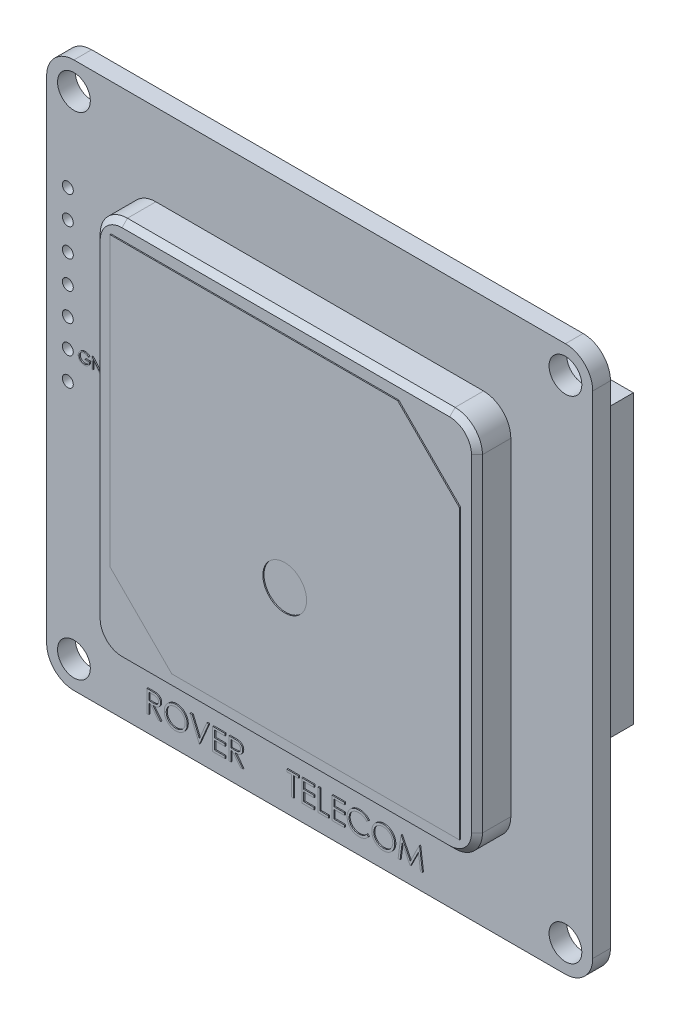
from build123d import *

# Parameters (mm, degrees)
SKETCH1_W                    = 50
SKETCH1_H                    = 50
BOSS_EXTRUDE1_DEPTH          = 1.62
SKETCH2_W                    = 35
SKETCH2_H                    = 35
BOSS_EXTRUDE2_DEPTH          = 3.1
SKETCH3_W                    = 32
SKETCH3_H                    = 32
BOSS_EXTRUDE3_DEPTH          = 0.1
F_3_0_3_DIAMETER_HOLE1_D     = 3
F_4_0_4_DIAMETER_HOLE1_D     = 4
F_4_0_4_DIAMETER_HOLE1_DEPTH = 0.1
FILLET1_R                    = 2.5
CHAMFER1_SIZE                = 5.656854249
CHAMFER2_SIZE                = 0.5
SKETCH8_W                    = 26.3
SKETCH8_H                    = 26.3
BOSS_EXTRUDE4_DEPTH          = 5.1
SKETCH9_W                    = 10.74
SKETCH9_H                    = 5.8
BOSS_EXTRUDE5_DEPTH          = 4.3
SKETCH9_3_W                  = 7.54
SKETCH9_3_H                  = 5.6
BOSS_EXTRUDE6_DEPTH          = 2.62
CUT_EXTRUDE1_DEPTH           = 37.83202954
CUT_EXTRUDE1_DEPTH_BACK      = 37.83202954
SKETCH10_R                   = 0.5
BOSS_EXTRUDE7_DEPTH          = 0.1
BOSS_EXTRUDE8_DEPTH          = 0.1


with BuildPart() as part:
    # Sketch1 → Boss-Extrude1 (new body)
    with BuildSketch(Plane.XY):
        Rectangle(SKETCH1_W, SKETCH1_H)
    extrude(amount=-BOSS_EXTRUDE1_DEPTH)

    # Sketch2 → Boss-Extrude2 (add)
    with BuildSketch(Plane.XY):
        Rectangle(SKETCH2_W, SKETCH2_H)
    extrude(amount=BOSS_EXTRUDE2_DEPTH)

    # Sketch3 → Boss-Extrude3 (add)
    with BuildSketch(Plane.XY.offset(3.1)):
        Rectangle(SKETCH3_W, SKETCH3_H)
    extrude(amount=BOSS_EXTRUDE3_DEPTH)

    # Ø3.0 (3) Diameter Hole1 (through all)
    with Locations(Plane.XY):
        with Locations((22.5, -22.5), (-22.5, 22.5), (22.5, 22.5), (-22.5, -22.5)):
            Hole(F_3_0_3_DIAMETER_HOLE1_D / 2)

    # Ø4.0 (4) Diameter Hole1
    with Locations(Plane.XY.offset(3.2)):
        with Locations((0, -4)):
            Hole(F_4_0_4_DIAMETER_HOLE1_D / 2, depth=F_4_0_4_DIAMETER_HOLE1_DEPTH)

    # Fillet1
    fillet1_edges = [part.edges().sort_by_distance(p)[0] for p in [
        (25, -25, -0.81),
        (25, 25, -0.81),
        (-25, -25, -0.81),
        (-25, 25, -0.81),
        (17.5, -17.5, 1.55),
        (17.5, 17.5, 1.55),
        (-17.5, -17.5, 1.55),
        (-17.5, 17.5, 1.55),
    ]]
    fillet(fillet1_edges, radius=FILLET1_R)

    # Chamfer1
    chamfer1_edges = [part.edges().sort_by_distance(p)[0] for p in [
        (-16, -16, 3.15),
        (16, 16, 3.15),
    ]]
    chamfer(chamfer1_edges, length=CHAMFER1_SIZE)

    # Chamfer2
    chamfer2_edges = [part.edges().sort_by_distance(p)[0] for p in [
        (17.5, 0, 3.1),
        (16.767766953, -16.767766953, 3.1),
        (16.767766953, 16.767766953, 3.1),
        (0, -17.5, 3.1),
        (0, 17.5, 3.1),
        (-16.767766953, -16.767766953, 3.1),
        (-16.767766953, 16.767766953, 3.1),
        (-17.5, 0, 3.1),
    ]]
    chamfer(chamfer2_edges, length=CHAMFER2_SIZE)

    # Sketch8 → Boss-Extrude4 (add)
    with BuildSketch(Plane(origin=(0, 0, -1.62), x_dir=(-1, 0, 0), z_dir=(0, 0, -1))):
        with Locations((-8.85, 4.35)):
            Rectangle(SKETCH8_W, SKETCH8_H)
    extrude(amount=BOSS_EXTRUDE4_DEPTH)

    # Sketch9 → Boss-Extrude5 (add)
    with BuildSketch(Plane(origin=(0, 0, -1.62), x_dir=(-1, 0, 0), z_dir=(0, 0, -1))):
        with Locations((-0.59, -22.1)):
            Rectangle(SKETCH9_W, SKETCH9_H)
        with Locations((11.35, -22.1)):
            Rectangle(SKETCH9_W, SKETCH9_H)
    extrude(amount=BOSS_EXTRUDE5_DEPTH)

    # Sketch9<3> → Boss-Extrude6 (add)
    with BuildSketch(Plane(origin=(0, 0, -1.62), x_dir=(-1, 0, 0), z_dir=(0, 0, -1))):
        with Locations((-13.23, -23.4)):
            Rectangle(SKETCH9_3_W, SKETCH9_3_H)
    extrude(amount=BOSS_EXTRUDE6_DEPTH)

    # Sketch10 → Cut-Extrude1 (cut, two sides: drawn at the far end of the back side and taken through both)
    with BuildSketch(Plane.XY.offset(-CUT_EXTRUDE1_DEPTH_BACK)):
        with Locations((-23.06, 14.6)):
            Circle(SKETCH10_R)
        with Locations((-23.06, 12.04)):
            Circle(SKETCH10_R)
        with Locations((-23.06, 9.48)):
            Circle(SKETCH10_R)
        with Locations((-23.06, 6.92)):
            Circle(SKETCH10_R)
        with Locations((-23.06, 4.36)):
            Circle(SKETCH10_R)
        with Locations((-23.06, 1.8)):
            Circle(SKETCH10_R)
        with Locations((-23.06, -0.76)):
            Circle(SKETCH10_R)
    extrude(amount=CUT_EXTRUDE1_DEPTH + CUT_EXTRUDE1_DEPTH_BACK, mode=Mode.SUBTRACT)

    # Sketch11 → Boss-Extrude7 (add)
    # profile 1 of 3: a face of its own
    with BuildSketch(Plane.XY):
        with BuildLine():
            Line((-21.023704934, 2.220769729), (-21.100628011, 2.147853062))
            add(Edge.make_bspline(
                [(-21.100628011, 2.147853062), (-21.114547693, 2.160947594), (-21.142055135, 2.186824412), (-21.186900919, 2.220398982), (-21.233690529, 2.249160725), (-21.282179813, 2.272562507), (-21.331167972, 2.291234724), (-21.380004765, 2.304528479), (-21.428189251, 2.313006347), (-21.460237028, 2.314020166), (-21.476028652, 2.314519729)],
                knots=[0, 0, 0, 0, 1.08915593, 2.152340314, 3.188132944, 4.216796309, 5.218260357, 6.173443236, 7.099959455, 8, 8, 8, 8], degree=3))
            add(Edge.make_bspline(
                [(-21.476028652, 2.314519729), (-21.485718566, 2.314401556), (-21.505073264, 2.314165516), (-21.53382239, 2.311152883), (-21.562270001, 2.306820065), (-21.590362394, 2.300550957), (-21.61815419, 2.292605511), (-21.645548731, 2.282666807), (-21.672597118, 2.271079595), (-21.699044569, 2.257690317), (-21.724684713, 2.242981789), (-21.748900952, 2.226682206), (-21.771847637, 2.20931398), (-21.793093473, 2.190442272), (-21.812760669, 2.170238025), (-21.831317347, 2.14907708), (-21.84811086, 2.126381303), (-21.863279764, 2.102568267), (-21.876811655, 2.078056213), (-21.888756985, 2.053081073), (-21.898784724, 2.027725686), (-21.906718855, 2.001958236), (-21.913264756, 1.975978067), (-21.917869786, 1.94960529), (-21.920465993, 1.922811665), (-21.920915073, 1.904869592), (-21.921140832, 1.895849857)],
                knots=[0, 0, 0, 0, 1.02818874, 2.053710826, 3.065248034, 4.081641283, 5.106893873, 6.131558223, 7.173050175, 8.228653731, 9.27666206, 10.308777013, 11.325269123, 12.329503258, 13.32196095, 14.316845687, 15.314881793, 16.315733098, 17.311955233, 18.285320748, 19.252783886, 20.203351036, 21.145449891, 22.095197417, 23.042428769, 24, 24, 24, 24], degree=3))
            add(Edge.make_bspline(
                [(-21.921140832, 1.895849857), (-21.920924912, 1.886629623), (-21.920493663, 1.868214334), (-21.917733571, 1.840730313), (-21.912611217, 1.813654484), (-21.9057633, 1.786897874), (-21.897197353, 1.760414661), (-21.886519448, 1.734319658), (-21.873872134, 1.708613832), (-21.859233119, 1.683528798), (-21.843179918, 1.659093649), (-21.82519618, 1.636076643), (-21.806093157, 1.614171278), (-21.785174899, 1.593863917), (-21.763112173, 1.574611375), (-21.739245809, 1.556944083), (-21.714045106, 1.540521733), (-21.687471616, 1.525551299), (-21.659813679, 1.512177432), (-21.631454606, 1.50028489), (-21.602303802, 1.490490794), (-21.572514462, 1.482508478), (-21.542122099, 1.475965536), (-21.510972441, 1.471756256), (-21.479294524, 1.468701733), (-21.457940629, 1.468478399), (-21.447182498, 1.468365883)],
                knots=[0, 0, 0, 0, 0.93586088, 1.869166235, 2.799637598, 3.729985548, 4.670839027, 5.622275134, 6.589130586, 7.576015415, 8.568469353, 9.55398029, 10.53834874, 11.515998671, 12.510579167, 13.508179873, 14.527009472, 15.561807829, 16.601455013, 17.643573243, 18.680854198, 19.719860599, 20.772568776, 21.833555941, 22.908541556, 24, 24, 24, 24], degree=3))
            add(Edge.make_bspline(
                [(-21.447182498, 1.468365883), (-21.434217256, 1.468636904), (-21.408757897, 1.4691691), (-21.371333199, 1.47331204), (-21.335389464, 1.479782552), (-21.301027692, 1.489258523), (-21.268207972, 1.501345287), (-21.236809989, 1.515915397), (-21.207080943, 1.5335277), (-21.178931465, 1.553405948), (-21.153000841, 1.575553043), (-21.129613948, 1.599451458), (-21.109143808, 1.624985192), (-21.091285323, 1.652003853), (-21.076511422, 1.680731083), (-21.064384909, 1.711026101), (-21.055089683, 1.742902533), (-21.051273975, 1.764928713), (-21.04934596, 1.77605819)],
                knots=[0, 0, 0, 0, 1.13008108, 2.219097802, 3.278683437, 4.311054135, 5.322181354, 6.324827112, 7.324222904, 8.330512327, 9.32562643, 10.293043162, 11.24128371, 12.174520618, 13.111833804, 14.052305215, 15.015860969, 16, 16, 16, 16], degree=3))
            Line((-21.04934596, 1.77605819), (-21.382679293, 1.77605819))
            Line((-21.382679293, 1.77605819), (-21.382679293, 1.878622293))
            Line((-21.382679293, 1.878622293), (-20.95960237, 1.878622293))
            add(Edge.make_bspline(
                [(-20.95960237, 1.878622293), (-20.960089755, 1.859505867), (-20.961043656, 1.82209157), (-20.967734775, 1.767528635), (-20.978539493, 1.715993866), (-20.993299582, 1.667432988), (-21.012406805, 1.621914819), (-21.035656099, 1.579393143), (-21.063419562, 1.540142663), (-21.094708259, 1.503842947), (-21.129822533, 1.471463172), (-21.167813567, 1.443004333), (-21.20874413, 1.419032157), (-21.252575503, 1.399529111), (-21.299164199, 1.384307969), (-21.348618021, 1.37351609), (-21.400869907, 1.367050386), (-21.436680386, 1.366224278), (-21.454994998, 1.36580178)],
                knots=[0, 0, 0, 0, 1.140356446, 2.231883559, 3.274166699, 4.278491846, 5.25512956, 6.21435461, 7.1637429, 8.11826594, 9.068280886, 10.0076534, 10.945064095, 11.891975133, 12.864533718, 13.863980011, 14.907571808, 16, 16, 16, 16], degree=3))
            add(Edge.make_bspline(
                [(-21.454994998, 1.36580178), (-21.466283608, 1.365964386), (-21.488548386, 1.366285098), (-21.521431508, 1.36856434), (-21.553407971, 1.372073076), (-21.584473116, 1.377371683), (-21.614741214, 1.383861584), (-21.644061096, 1.392172075), (-21.67254445, 1.401791703), (-21.700235303, 1.412733324), (-21.726882317, 1.42541094), (-21.752604179, 1.439499409), (-21.777543072, 1.454926083), (-21.801529119, 1.471957754), (-21.824687297, 1.490467028), (-21.84686828, 1.510491005), (-21.868196246, 1.531968468), (-21.881556378, 1.547219613), (-21.888288267, 1.554904344)],
                knots=[0, 0, 0, 0, 1.107784379, 2.184907829, 3.233506516, 4.263428166, 5.276301166, 6.270063455, 7.25232949, 8.225834625, 9.190232166, 10.146266622, 11.1027726, 12.066435141, 13.031522626, 14.010570082, 14.99756817, 16, 16, 16, 16], degree=3))
            add(Edge.make_bspline(
                [(-21.888288267, 1.554904344), (-21.898055677, 1.567095959), (-21.917428366, 1.591276821), (-21.942364982, 1.630019663), (-21.963622526, 1.67013448), (-21.980870475, 1.711732945), (-21.9943385, 1.754776149), (-22.003997429, 1.799209089), (-22.009656654, 1.845088983), (-22.010471951, 1.876136202), (-22.010884421, 1.891843447)],
                knots=[0, 0, 0, 0, 1.023165419, 2.029347347, 3.013907458, 3.994755782, 4.975994455, 5.96558838, 6.970761222, 8, 8, 8, 8], degree=3))
            add(Edge.make_bspline(
                [(-22.010884421, 1.891843447), (-22.010732353, 1.903605233), (-22.01043015, 1.926979321), (-22.006765717, 1.961681409), (-22.001508169, 1.995767321), (-21.993780439, 2.029209194), (-21.984038649, 2.062029363), (-21.97188051, 2.094243067), (-21.957724825, 2.125869316), (-21.941271827, 2.156690421), (-21.922961981, 2.186297396), (-21.903090489, 2.214571055), (-21.881375175, 2.240996502), (-21.858170661, 2.265908401), (-21.833200092, 2.288993786), (-21.8066974, 2.310466389), (-21.778642159, 2.330355014), (-21.748946108, 2.348346395), (-21.718052483, 2.364507429), (-21.68603534, 2.378675776), (-21.652904451, 2.390385294), (-21.618908029, 2.40032066), (-21.583788743, 2.407667843), (-21.547801447, 2.412996056), (-21.510758558, 2.416641942), (-21.485719692, 2.416935157), (-21.473023844, 2.417083831)],
                knots=[0, 0, 0, 0, 1.008945113, 2.00506715, 2.99143336, 3.967273523, 4.948097931, 5.927297278, 6.919902385, 7.919676788, 8.923139349, 9.905703106, 10.883022732, 11.856032218, 12.825136022, 13.798837087, 14.781400844, 15.773989409, 16.776158564, 17.77167057, 18.775803737, 19.789618931, 20.80898985, 21.851988756, 22.910860228, 24, 24, 24, 24], degree=3))
            add(Edge.make_bspline(
                [(-21.473023844, 2.417083831), (-21.46267006, 2.416918262), (-21.442139724, 2.416589958), (-21.411589514, 2.414314345), (-21.38151151, 2.410707521), (-21.351861113, 2.405785582), (-21.322739294, 2.399081671), (-21.294063093, 2.391059304), (-21.265790939, 2.381718783), (-21.23801144, 2.370579113), (-21.210537807, 2.35793522), (-21.183217281, 2.343702813), (-21.15614321, 2.327638526), (-21.129268644, 2.309694659), (-21.102424113, 2.290179397), (-21.076034216, 2.26853459), (-21.049461946, 2.245613803), (-21.032375713, 2.229133179), (-21.023704934, 2.220769729)],
                knots=[0, 0, 0, 0, 0.985871117, 1.954866573, 2.915460327, 3.869826059, 4.81536089, 5.759505086, 6.70452669, 7.649098992, 8.607881297, 9.583363685, 10.581137262, 11.603961102, 12.659522466, 13.73993555, 14.853081303, 16, 16, 16, 16], degree=3))
        make_face()
    # profile 2 of 3: a face of its own
    with BuildSketch(Plane.XY):
        Polygon((-20.754474165, 1.391442806), (-20.754474165, 2.391442806), (-20.735644037, 2.391442806), (-20.074986985, 1.604383511), (-20.074986985, 2.391442806), (-19.985243396, 2.391442806), (-19.985243396, 1.391442806), (-20.005676088, 1.391442806), (-20.664730575, 2.176699216), (-20.664730575, 1.391442806), align=None)
    # profile 3 of 3: a face of its own
    with BuildSketch(Plane.XY):
        with BuildLine():
            Line((-19.728833139, 1.391442806), (-19.728833139, 2.391442806))
            Line((-19.728833139, 2.391442806), (-19.526910062, 2.391442806))
            add(Edge.make_bspline(
                [(-19.526910062, 2.391442806), (-19.509347494, 2.391316357), (-19.475416704, 2.391072059), (-19.426384576, 2.38952309), (-19.381017787, 2.386782957), (-19.339465542, 2.382791664), (-19.301613767, 2.377890797), (-19.26756845, 2.371747825), (-19.237153552, 2.364494062), (-19.218447998, 2.358309647), (-19.20960237, 2.355385113)],
                knots=[0, 0, 0, 0, 1.314313732, 2.53924729, 3.670748893, 4.714932338, 5.66265055, 6.526160246, 7.303039223, 8, 8, 8, 8], degree=3))
            add(Edge.make_bspline(
                [(-19.20960237, 2.355385113), (-19.198032444, 2.35097634), (-19.175154961, 2.342258771), (-19.142581497, 2.325814113), (-19.111917108, 2.307181798), (-19.082997352, 2.286337266), (-19.05648283, 2.262690309), (-19.031337717, 2.237245428), (-19.008590653, 2.209077331), (-18.987759711, 2.178770191), (-18.968978094, 2.146681033), (-18.952652621, 2.112871002), (-18.939094337, 2.0775118), (-18.927839129, 2.040701758), (-18.918968713, 2.002359935), (-18.912916732, 1.962441688), (-18.908925021, 1.921104777), (-18.908523863, 1.89305493), (-18.908320319, 1.878822613)],
                knots=[0, 0, 0, 0, 0.984719456, 1.947108742, 2.898477687, 3.838006223, 4.779231079, 5.722358779, 6.681677486, 7.655904652, 8.64651281, 9.637519902, 10.640069247, 11.656948941, 12.698408672, 13.768548281, 14.867775369, 16, 16, 16, 16], degree=3))
            add(Edge.make_bspline(
                [(-18.908320319, 1.878822613), (-18.908500024, 1.86646226), (-18.908854151, 1.842104891), (-18.912033956, 1.806207493), (-18.916655761, 1.771375044), (-18.923811246, 1.737773415), (-18.932497679, 1.70510821), (-18.943630294, 1.673727569), (-18.956383292, 1.643343623), (-18.971254686, 1.614367201), (-18.987580796, 1.586914809), (-19.005101294, 1.561036087), (-19.023797493, 1.537100309), (-19.043847674, 1.515034992), (-19.064992736, 1.494873398), (-19.087371116, 1.476447108), (-19.111040559, 1.460116663), (-19.135895051, 1.445240347), (-19.16265966, 1.432263102), (-19.191841336, 1.4212831), (-19.223564529, 1.412184067), (-19.257751374, 1.404592382), (-19.294460939, 1.398570296), (-19.333729215, 1.394534183), (-19.375495869, 1.391804774), (-19.404175659, 1.391565805), (-19.418937306, 1.391442806)],
                knots=[0, 0, 0, 0, 1.105936401, 2.179363191, 3.223086493, 4.248585256, 5.251745608, 6.245858792, 7.225916811, 8.198733463, 9.158002045, 10.082870192, 10.993790845, 11.873723703, 12.748670949, 13.606408763, 14.465103618, 15.319838547, 16.196477973, 17.123216899, 18.106603292, 19.147568657, 20.255746949, 21.433717677, 22.679120308, 24, 24, 24, 24], degree=3))
            Line((-19.418937306, 1.391442806), (-19.728833139, 1.391442806))
        make_face()
        with BuildLine():
            Line((-19.639089549, 1.494006908), (-19.524305896, 1.494006908))
            add(Edge.make_bspline(
                [(-19.524305896, 1.494006908), (-19.507812075, 1.494077793), (-19.476088419, 1.49421413), (-19.430471848, 1.495410474), (-19.38879202, 1.497365313), (-19.351043018, 1.50010105), (-19.317246154, 1.503720654), (-19.287330797, 1.507756341), (-19.261395009, 1.512784184), (-19.245700884, 1.517341601), (-19.238448524, 1.519447613)],
                knots=[0, 0, 0, 0, 1.375205317, 2.645023457, 3.804390687, 4.853969522, 5.800190428, 6.637939096, 7.370582563, 8, 8, 8, 8], degree=3))
            add(Edge.make_bspline(
                [(-19.238448524, 1.519447613), (-19.22932042, 1.522662344), (-19.211282238, 1.529015022), (-19.185316214, 1.540602926), (-19.161099927, 1.554329231), (-19.138211348, 1.569587024), (-19.116975161, 1.586914453), (-19.097139699, 1.605934735), (-19.078744899, 1.626744671), (-19.061980811, 1.649318432), (-19.046978438, 1.673515516), (-19.033986658, 1.69909804), (-19.022600506, 1.7257857), (-19.013663765, 1.753988317), (-19.006659313, 1.783453762), (-19.001697973, 1.814184109), (-18.998608052, 1.846173618), (-18.998247638, 1.867931368), (-18.998063908, 1.879022934)],
                knots=[0, 0, 0, 0, 0.998632004, 1.973411704, 2.929992603, 3.868527914, 4.809262121, 5.754881198, 6.702106254, 7.672490631, 8.653608572, 9.636854334, 10.631411391, 11.644891563, 12.686317036, 13.754757253, 14.855430412, 16, 16, 16, 16], degree=3))
            add(Edge.make_bspline(
                [(-18.998063908, 1.879022934), (-18.998210562, 1.890718214), (-18.998498664, 1.913693695), (-19.002119896, 1.947405322), (-19.007411769, 1.979828365), (-19.01506425, 2.010964993), (-19.02481593, 2.04087595), (-19.036985828, 2.069395811), (-19.050890576, 2.096825773), (-19.067434387, 2.122532735), (-19.085553128, 2.146845052), (-19.105661093, 2.169117885), (-19.127438818, 2.18940197), (-19.150648775, 2.208013203), (-19.175945089, 2.224202824), (-19.202731858, 2.238684733), (-19.23140205, 2.250974988), (-19.251348535, 2.257511806), (-19.261485383, 2.260833831)],
                knots=[0, 0, 0, 0, 1.122418816, 2.205001699, 3.251619955, 4.274784885, 5.280384055, 6.268708349, 7.249350384, 8.229342522, 9.199999885, 10.157847722, 11.105861043, 12.055065948, 13.010012805, 13.98527497, 14.976112212, 16, 16, 16, 16], degree=3))
            add(Edge.make_bspline(
                [(-19.261485383, 2.260833831), (-19.269871425, 2.263152811), (-19.28770245, 2.268083597), (-19.31679944, 2.273462275), (-19.349546626, 2.278206418), (-19.386089397, 2.282223), (-19.4263861, 2.285105092), (-19.470467725, 2.287268325), (-19.518353326, 2.288727363), (-19.551548336, 2.288826993), (-19.568777049, 2.288878703)],
                knots=[0, 0, 0, 0, 0.674548936, 1.434276114, 2.292660221, 3.240891867, 4.284742987, 5.42552168, 6.663806718, 8, 8, 8, 8], degree=3))
            Line((-19.568777049, 2.288878703), (-19.639089549, 2.288878703))
            Line((-19.639089549, 2.288878703), (-19.639089549, 1.494006908))
        make_face(mode=Mode.SUBTRACT)
    extrude(amount=BOSS_EXTRUDE7_DEPTH)

    # Sketch12 → Boss-Extrude8 (add)
    # profile 1 of 12: a face of its own
    with BuildSketch(Plane.XY):
        with BuildLine():
            Line((-15.72093604, -21.389453916), (-15.320695656, -21.389453916))
            add(Edge.make_bspline(
                [(-15.320695656, -21.389453916), (-15.29398644, -21.389542822), (-15.242701786, -21.389713532), (-15.169231345, -21.390665396), (-15.102473004, -21.3933936), (-15.042461667, -21.395741362), (-14.989198436, -21.400022471), (-14.942519984, -21.404114269), (-14.9026413, -21.409470647), (-14.878500813, -21.414445174), (-14.867570656, -21.416697506)],
                knots=[0, 0, 0, 0, 1.410062039, 2.707475311, 3.878576406, 4.937260626, 5.877586885, 6.699081471, 7.410979367, 8, 8, 8, 8], degree=3))
            add(Edge.make_bspline(
                [(-14.867570656, -21.416697506), (-14.852938299, -21.4203128), (-14.823985734, -21.427466265), (-14.782299982, -21.442586037), (-14.742577511, -21.460082965), (-14.704983326, -21.480633663), (-14.669705731, -21.50439068), (-14.636380982, -21.530943892), (-14.60485786, -21.56014801), (-14.576411214, -21.592739348), (-14.549588899, -21.626931639), (-14.526966826, -21.663905214), (-14.507465981, -21.702568945), (-14.491939971, -21.74331604), (-14.479438272, -21.785751339), (-14.470623278, -21.830259222), (-14.465336885, -21.876636922), (-14.464798682, -21.908270013), (-14.464525784, -21.924309685)],
                knots=[0, 0, 0, 0, 1.027469482, 2.033020251, 3.019912614, 3.986113645, 4.951240523, 5.91722682, 6.890402269, 7.87763091, 8.8651537, 9.85103654, 10.82876324, 11.815024772, 12.821070561, 13.842952187, 14.906261191, 16, 16, 16, 16], degree=3))
            add(Edge.make_bspline(
                [(-14.464525784, -21.924309685), (-14.465365212, -21.950958316), (-14.467003152, -22.002956698), (-14.48227464, -22.078420059), (-14.507289794, -22.148813953), (-14.541760245, -22.214049746), (-14.585657088, -22.272855829), (-14.638414112, -22.324507518), (-14.700060747, -22.367730325), (-14.757448927, -22.397703356), (-14.808142756, -22.416899304), (-14.849876077, -22.430405795), (-14.895400064, -22.440841203), (-14.944278541, -22.45018985), (-14.996714916, -22.457247961), (-15.05258351, -22.462417444), (-15.111924168, -22.465648329), (-15.15268935, -22.466129474), (-15.173660399, -22.466376993)],
                knots=[0, 0, 0, 0, 1.260483769, 2.459530307, 3.627416485, 4.787058657, 5.939039949, 7.08810263, 8.267026773, 9.491475466, 10.141966685, 10.831826277, 11.566392101, 12.351337768, 13.187381173, 14.07005841, 15.007169909, 16, 16, 16, 16], degree=3))
            Line((-15.173660399, -22.466376993), (-14.438884758, -23.389453916))
            Line((-14.438884758, -23.389453916), (-14.660839887, -23.389453916))
            Line((-14.660839887, -23.389453916), (-15.395615528, -22.466376993))
            Line((-15.395615528, -22.466376993), (-15.541448861, -22.466376993))
            Line((-15.541448861, -22.466376993), (-15.541448861, -23.389453916))
            Line((-15.541448861, -23.389453916), (-15.72093604, -23.389453916))
            Line((-15.72093604, -23.389453916), (-15.72093604, -21.389453916))
        make_face()
        with BuildLine():
            Line((-15.541448861, -21.594582121), (-15.541448861, -22.261248788))
            Line((-15.541448861, -22.261248788), (-15.175262964, -22.264053275))
            add(Edge.make_bspline(
                [(-15.175262964, -22.264053275), (-15.158165798, -22.264060839), (-15.125026623, -22.264075499), (-15.077083386, -22.261793342), (-15.032443322, -22.25919716), (-14.991277178, -22.255226105), (-14.953566563, -22.25010835), (-14.919330327, -22.243706645), (-14.888512583, -22.236248323), (-14.852570561, -22.224704537), (-14.812435401, -22.206415384), (-14.768817424, -22.179806527), (-14.731673231, -22.146338459), (-14.700291595, -22.108067913), (-14.675074777, -22.065990056), (-14.65729646, -22.020609274), (-14.646015065, -21.973071218), (-14.644684467, -21.940398013), (-14.644012964, -21.923909044)],
                knots=[0, 0, 0, 0, 1.146690395, 2.22261258, 3.21895312, 4.145990853, 4.996080663, 5.770904154, 6.481378293, 7.121626537, 8.300444488, 9.431385265, 10.535395872, 11.636531494, 12.74115979, 13.810798291, 14.895190096, 16, 16, 16, 16], degree=3))
            add(Edge.make_bspline(
                [(-14.644012964, -21.923909044), (-14.64469989, -21.907825288), (-14.646061127, -21.875953151), (-14.657174709, -21.829292631), (-14.675968641, -21.785254374), (-14.701295635, -21.744017525), (-14.732152294, -21.706585676), (-14.768333902, -21.674558732), (-14.808851156, -21.648130466), (-14.846720412, -21.631242249), (-14.880568534, -21.620888047), (-14.909956911, -21.613601667), (-14.94316347, -21.607747685), (-14.980349446, -21.603057365), (-15.021356092, -21.599025968), (-15.06639075, -21.596310666), (-15.115154624, -21.594702744), (-15.148952871, -21.594623264), (-15.166448861, -21.594582121)],
                knots=[0, 0, 0, 0, 1.101028733, 2.181837193, 3.264309656, 4.369019818, 5.486613113, 6.575447106, 7.666700264, 8.788928104, 9.402425223, 10.0903467, 10.862060571, 11.710948788, 12.657782767, 13.684531032, 14.801375019, 16, 16, 16, 16], degree=3))
            Line((-15.166448861, -21.594582121), (-15.541448861, -21.594582121))
        make_face(mode=Mode.SUBTRACT)
    # profile 2 of 12: a face of its own
    with BuildSketch(Plane.XY):
        with BuildLine():
            add(Edge.make_bspline(
                [(-13.092730912, -21.338171865), (-13.055697709, -21.339109853), (-12.982961442, -21.340952139), (-12.8760615, -21.355054484), (-12.77400716, -21.37945185), (-12.675967081, -21.411944982), (-12.583113952, -21.455290345), (-12.49474887, -21.507681859), (-12.411082085, -21.569668407), (-12.333241296, -21.640770822), (-12.262008753, -21.718132796), (-12.199251103, -21.800691601), (-12.146655507, -21.88794806), (-12.103463628, -21.979639963), (-12.069578709, -22.075559945), (-12.046196398, -22.176219375), (-12.031260312, -22.280966055), (-12.029514154, -22.352409978), (-12.028628348, -22.388652634)],
                knots=[0, 0, 0, 0, 1.065120563, 2.091984664, 3.0946048, 4.079830382, 5.057816894, 6.036188127, 7.030412546, 8.04752943, 9.064399622, 10.05169764, 11.02544977, 11.989514704, 12.962713494, 13.945757189, 14.957906945, 16, 16, 16, 16], degree=3))
            add(Edge.make_bspline(
                [(-12.028628348, -22.388652634), (-12.029514024, -22.424628317), (-12.031259793, -22.495540558), (-12.04621338, -22.599622526), (-12.06966538, -22.699674352), (-12.103148961, -22.795529011), (-12.146134949, -22.887287619), (-12.199080761, -22.974708735), (-12.261447167, -23.05782102), (-12.332422511, -23.135713972), (-12.409794535, -23.207141098), (-12.492783258, -23.269380455), (-12.579522298, -23.322937098), (-12.671127846, -23.365670626), (-12.76638501, -23.399826009), (-12.866146337, -23.423113226), (-12.969944368, -23.438134394), (-13.040727799, -23.43985926), (-13.076705271, -23.440735967)],
                knots=[0, 0, 0, 0, 1.043624062, 2.057103931, 3.04512605, 4.022047818, 4.998200453, 5.980619268, 6.982898556, 8.009068085, 9.034988726, 10.034168286, 11.015286542, 11.987931943, 12.962482838, 13.94673481, 14.956375938, 16, 16, 16, 16], degree=3))
            add(Edge.make_bspline(
                [(-13.076705271, -23.440735967), (-13.112947739, -23.439850603), (-13.184391291, -23.438105315), (-13.289269597, -23.423144512), (-13.389999736, -23.399749482), (-13.486293651, -23.366315518), (-13.57820504, -23.323105672), (-13.665913658, -23.270417455), (-13.749067457, -23.207899089), (-13.826977026, -23.136946761), (-13.898262282, -23.059705874), (-13.960410497, -22.976943442), (-14.013110562, -22.890283181), (-14.056175323, -22.799484596), (-14.0902693, -22.704986629), (-14.113529196, -22.606158928), (-14.128578312, -22.503564924), (-14.13031251, -22.433711839), (-14.131192451, -22.398268018)],
                knots=[0, 0, 0, 0, 1.053102029, 2.075944431, 3.073151272, 4.055350789, 5.033113405, 6.020478099, 7.024410459, 8.052272461, 9.079885166, 10.07527673, 11.055994387, 12.023226415, 12.992069828, 13.970394897, 14.97016774, 16, 16, 16, 16], degree=3))
            add(Edge.make_bspline(
                [(-14.131192451, -22.398268018), (-14.130886945, -22.374477922), (-14.130279787, -22.327197851), (-14.122970248, -22.256988365), (-14.112363562, -22.187907989), (-14.097162469, -22.120153162), (-14.077281516, -22.053889742), (-14.053823215, -21.988660735), (-14.025171875, -21.925127178), (-13.992782933, -21.862988097), (-13.956633328, -21.803212151), (-13.916704329, -21.746709532), (-13.874398404, -21.693006106), (-13.828019322, -21.643493532), (-13.779095639, -21.596731443), (-13.726833709, -21.553438461), (-13.671552426, -21.513224204), (-13.613013923, -21.476984009), (-13.552660623, -21.444207361), (-13.490445322, -21.416080589), (-13.427212995, -21.391939982), (-13.362667482, -21.372373796), (-13.296980184, -21.356926918), (-13.230007735, -21.346408431), (-13.161803492, -21.339080249), (-13.115854167, -21.338475962), (-13.092730912, -21.338171865)],
                knots=[0, 0, 0, 0, 1.037015668, 2.060948919, 3.074880161, 4.083647147, 5.086022904, 6.090072063, 7.104153813, 8.122640571, 9.144368836, 10.147691507, 11.138137339, 12.123020368, 13.103399296, 14.087645067, 15.080126199, 16.082011238, 17.087798457, 18.072939717, 19.057185487, 20.037253025, 21.01195951, 21.997135196, 22.992090687, 24, 24, 24, 24], degree=3))
        make_face()
        with BuildLine():
            add(Edge.make_bspline(
                [(-13.08391681, -21.54330007), (-13.1028966, -21.543531435), (-13.140674733, -21.543991955), (-13.196837326, -21.550058079), (-13.252261288, -21.558703729), (-13.306958066, -21.571036027), (-13.360698803, -21.587838343), (-13.413984426, -21.607176005), (-13.466329029, -21.630730914), (-13.517559805, -21.657343887), (-13.567225562, -21.686800414), (-13.614089963, -21.719355709), (-13.658274331, -21.754246312), (-13.699670483, -21.791553647), (-13.738156867, -21.831467705), (-13.774490982, -21.873383383), (-13.807216457, -21.918498749), (-13.837208216, -21.96559041), (-13.864046981, -22.014597028), (-13.887912898, -22.065002664), (-13.907435189, -22.117218485), (-13.923356547, -22.170678004), (-13.936556439, -22.225296552), (-13.944918681, -22.281488466), (-13.951051458, -22.338971387), (-13.951485656, -22.37781816), (-13.951705271, -22.397466736)],
                knots=[0, 0, 0, 0, 1.008559885, 2.007477868, 2.99961109, 3.989939068, 4.984837346, 5.991145699, 7.001802488, 8.033829008, 9.059044045, 10.069351652, 11.065060232, 12.050310815, 13.029377138, 14.011219647, 14.996725999, 15.989392538, 16.977580475, 17.965360261, 18.951710183, 19.937753436, 20.929683414, 21.935841486, 22.955955122, 24, 24, 24, 24], degree=3))
            add(Edge.make_bspline(
                [(-13.951705271, -22.397466736), (-13.950976779, -22.426359434), (-13.949543608, -22.483200308), (-13.936996426, -22.566496391), (-13.917669583, -22.64654684), (-13.889179659, -22.722913645), (-13.853550737, -22.796253235), (-13.809535371, -22.865915009), (-13.757387322, -22.931917795), (-13.698151021, -22.993800806), (-13.633395189, -23.050284122), (-13.564633629, -23.099863213), (-13.492602996, -23.141811927), (-13.417115451, -23.175986254), (-13.338574001, -23.203066104), (-13.256472543, -23.221625322), (-13.171357994, -23.233839868), (-13.113340477, -23.235012872), (-13.08391681, -23.235607762)],
                knots=[0, 0, 0, 0, 1.032063989, 2.030389145, 3.003944642, 3.970395727, 4.937377036, 5.913328081, 6.909231446, 7.93887556, 8.970685674, 9.976071282, 10.964166581, 11.944589148, 12.933237628, 13.927779006, 14.949070134, 16, 16, 16, 16], degree=3))
            add(Edge.make_bspline(
                [(-13.08391681, -23.235607762), (-13.064139952, -23.235336045), (-13.024916502, -23.234797149), (-12.966576204, -23.229369334), (-12.90928694, -23.220665408), (-12.853129066, -23.208133605), (-12.798166316, -23.192449487), (-12.744169286, -23.1738165), (-12.69171312, -23.150570098), (-12.64013607, -23.124885554), (-12.590766789, -23.095605464), (-12.543637913, -23.064155093), (-12.499937353, -23.029315881), (-12.45857217, -22.992562845), (-12.419927776, -22.953154932), (-12.384265499, -22.911143377), (-12.351705424, -22.866263001), (-12.321725054, -22.819242769), (-12.294980333, -22.770102054), (-12.27167799, -22.719513666), (-12.251908781, -22.667602175), (-12.235949636, -22.614292706), (-12.223443658, -22.559686506), (-12.214826561, -22.503710462), (-12.208798881, -22.446476552), (-12.208344552, -22.407765777), (-12.208115528, -22.388251993)],
                knots=[0, 0, 0, 0, 1.047197238, 2.076906641, 3.100256066, 4.114471768, 5.12198147, 6.126382909, 7.136867548, 8.15857795, 9.17633901, 10.174870724, 11.156907918, 12.133735059, 13.104061851, 14.077631395, 15.04955518, 16.038496417, 17.029181396, 18.010275684, 18.986308667, 19.968651475, 20.955262928, 21.950658345, 22.966943676, 24, 24, 24, 24], degree=3))
            add(Edge.make_bspline(
                [(-12.208115528, -22.388251993), (-12.208344735, -22.368871705), (-12.20879941, -22.330427333), (-12.214823681, -22.27359258), (-12.223452762, -22.218019316), (-12.235888595, -22.163925714), (-12.251917254, -22.111297986), (-12.271681443, -22.060185558), (-12.294987328, -22.010398018), (-12.321734885, -21.96205842), (-12.35180107, -21.915672855), (-12.384654923, -21.87132862), (-12.420863694, -21.829858482), (-12.459392851, -21.790238657), (-12.501204785, -21.753314148), (-12.546110096, -21.719072708), (-12.593563626, -21.68668798), (-12.643807761, -21.657473373), (-12.695661449, -21.630493812), (-12.748869425, -21.607378953), (-12.80282891, -21.587737741), (-12.857402688, -21.57098519), (-12.913050105, -21.55875203), (-12.96939515, -21.550050287), (-13.026359869, -21.543994067), (-13.06467028, -21.543532136), (-13.08391681, -21.54330007)],
                knots=[0, 0, 0, 0, 1.02996197, 2.043119294, 3.035359645, 4.018872909, 4.991431989, 5.957985074, 6.929999688, 7.912076566, 8.892894881, 9.867085534, 10.843653904, 11.817741046, 12.803660682, 13.806313499, 14.818574707, 15.856120519, 16.894564902, 17.924820532, 18.937903209, 19.946497019, 20.957711757, 21.963978472, 22.977135795, 24, 24, 24, 24], degree=3))
        make_face(mode=Mode.SUBTRACT)
    # profile 3 of 12: a face of its own
    with BuildSketch(Plane.XY):
        Polygon((-11.772218092, -21.389453916), (-11.579910399, -21.389453916), (-10.913243733, -22.965575711), (-10.246577066, -21.389453916), (-10.054269374, -21.389453916), (-10.90042322, -23.389453916), (-10.926064246, -23.389453916), align=None)
    # profile 4 of 12: a face of its own
    with BuildSketch(Plane.XY):
        Polygon((-9.695295015, -21.389453916), (-8.567089887, -21.389453916), (-8.567089887, -21.594582121), (-9.515807835, -21.594582121), (-9.515807835, -22.209966736), (-8.567089887, -22.209966736), (-8.567089887, -22.415094941), (-9.515807835, -22.415094941), (-9.515807835, -23.184325711), (-8.567089887, -23.184325711), (-8.567089887, -23.389453916), (-9.695295015, -23.389453916), align=None)
    # profile 5 of 12: a face of its own
    with BuildSketch(Plane.XY):
        with BuildLine():
            Line((-8.208115528, -21.389453916), (-7.807875143, -21.389453916))
            add(Edge.make_bspline(
                [(-7.807875143, -21.389453916), (-7.781165927, -21.389542822), (-7.729881273, -21.389713532), (-7.656410833, -21.390665396), (-7.589652491, -21.3933936), (-7.529641155, -21.395741362), (-7.476377923, -21.400022471), (-7.429699471, -21.404114269), (-7.389820787, -21.409470647), (-7.365680301, -21.414445174), (-7.354750143, -21.416697506)],
                knots=[0, 0, 0, 0, 1.410062039, 2.707475311, 3.878576406, 4.937260626, 5.877586885, 6.699081471, 7.410979367, 8, 8, 8, 8], degree=3))
            add(Edge.make_bspline(
                [(-7.354750143, -21.416697506), (-7.340117786, -21.4203128), (-7.311165221, -21.427466265), (-7.269479469, -21.442586037), (-7.229756998, -21.460082965), (-7.192162813, -21.480633663), (-7.156885218, -21.50439068), (-7.123560469, -21.530943892), (-7.092037347, -21.56014801), (-7.063590701, -21.592739348), (-7.036768386, -21.626931639), (-7.014146313, -21.663905214), (-6.994645468, -21.702568945), (-6.979119458, -21.74331604), (-6.966617759, -21.785751339), (-6.957802765, -21.830259222), (-6.952516372, -21.876636922), (-6.951978169, -21.908270013), (-6.951705271, -21.924309685)],
                knots=[0, 0, 0, 0, 1.027469482, 2.033020251, 3.019912614, 3.986113645, 4.951240523, 5.91722682, 6.890402269, 7.87763091, 8.8651537, 9.85103654, 10.82876324, 11.815024772, 12.821070561, 13.842952187, 14.906261191, 16, 16, 16, 16], degree=3))
            add(Edge.make_bspline(
                [(-6.951705271, -21.924309685), (-6.952544699, -21.950958316), (-6.954182639, -22.002956698), (-6.969454127, -22.078420059), (-6.994469281, -22.148813953), (-7.028939732, -22.214049746), (-7.072836575, -22.272855829), (-7.125593599, -22.324507518), (-7.187240234, -22.367730325), (-7.244628414, -22.397703356), (-7.295322243, -22.416899304), (-7.337055564, -22.430405795), (-7.382579552, -22.440841203), (-7.431458028, -22.45018985), (-7.483894403, -22.457247961), (-7.539762997, -22.462417444), (-7.599103655, -22.465648329), (-7.639868838, -22.466129474), (-7.660839887, -22.466376993)],
                knots=[0, 0, 0, 0, 1.260483769, 2.459530307, 3.627416485, 4.787058657, 5.939039949, 7.08810263, 8.267026773, 9.491475466, 10.141966685, 10.831826277, 11.566392101, 12.351337768, 13.187381173, 14.07005841, 15.007169909, 16, 16, 16, 16], degree=3))
            Line((-7.660839887, -22.466376993), (-6.926064246, -23.389453916))
            Line((-6.926064246, -23.389453916), (-7.148019374, -23.389453916))
            Line((-7.148019374, -23.389453916), (-7.882795015, -22.466376993))
            Line((-7.882795015, -22.466376993), (-8.028628348, -22.466376993))
            Line((-8.028628348, -22.466376993), (-8.028628348, -23.389453916))
            Line((-8.028628348, -23.389453916), (-8.208115528, -23.389453916))
            Line((-8.208115528, -23.389453916), (-8.208115528, -21.389453916))
        make_face()
        with BuildLine():
            Line((-8.028628348, -21.594582121), (-8.028628348, -22.261248788))
            Line((-8.028628348, -22.261248788), (-7.662442451, -22.264053275))
            add(Edge.make_bspline(
                [(-7.662442451, -22.264053275), (-7.645345286, -22.264060839), (-7.61220611, -22.264075499), (-7.564262873, -22.261793342), (-7.519622809, -22.25919716), (-7.478456665, -22.255226105), (-7.440746051, -22.25010835), (-7.406509815, -22.243706645), (-7.375692071, -22.236248323), (-7.339750049, -22.224704537), (-7.299614888, -22.206415384), (-7.255996911, -22.179806527), (-7.218852718, -22.146338459), (-7.187471082, -22.108067913), (-7.162254264, -22.065990056), (-7.144475947, -22.020609274), (-7.133194552, -21.973071218), (-7.131863954, -21.940398013), (-7.131192451, -21.923909044)],
                knots=[0, 0, 0, 0, 1.146690395, 2.22261258, 3.21895312, 4.145990853, 4.996080663, 5.770904154, 6.481378293, 7.121626537, 8.300444488, 9.431385265, 10.535395872, 11.636531494, 12.74115979, 13.810798291, 14.895190096, 16, 16, 16, 16], degree=3))
            add(Edge.make_bspline(
                [(-7.131192451, -21.923909044), (-7.131879377, -21.907825288), (-7.133240614, -21.875953151), (-7.144354196, -21.829292631), (-7.163148129, -21.785254374), (-7.188475122, -21.744017525), (-7.219331782, -21.706585676), (-7.255513389, -21.674558732), (-7.296030643, -21.648130466), (-7.3338999, -21.631242249), (-7.367748021, -21.620888047), (-7.397136398, -21.613601667), (-7.430342957, -21.607747685), (-7.467528933, -21.603057365), (-7.508535579, -21.599025968), (-7.553570237, -21.596310666), (-7.602334112, -21.594702744), (-7.636132358, -21.594623264), (-7.653628348, -21.594582121)],
                knots=[0, 0, 0, 0, 1.101028733, 2.181837193, 3.264309656, 4.369019818, 5.486613113, 6.575447106, 7.666700264, 8.788928104, 9.402425223, 10.0903467, 10.862060571, 11.710948788, 12.657782767, 13.684531032, 14.801375019, 16, 16, 16, 16], degree=3))
            Line((-7.653628348, -21.594582121), (-8.028628348, -21.594582121))
        make_face(mode=Mode.SUBTRACT)
    # profile 6 of 12: a face of its own
    with BuildSketch(Plane.XY):
        Polygon((-2.90042322, -21.594582121), (-2.90042322, -21.389453916), (-1.849141169, -21.389453916), (-1.849141169, -21.594582121), (-2.285038605, -21.594582121), (-2.285038605, -23.389453916), (-2.464525784, -23.389453916), (-2.464525784, -21.594582121), align=None)
    # profile 7 of 12: a face of its own
    with BuildSketch(Plane.XY):
        Polygon((-1.541448861, -21.389453916), (-0.413243733, -21.389453916), (-0.413243733, -21.594582121), (-1.361961681, -21.594582121), (-1.361961681, -22.209966736), (-0.413243733, -22.209966736), (-0.413243733, -22.415094941), (-1.361961681, -22.415094941), (-1.361961681, -23.184325711), (-0.413243733, -23.184325711), (-0.413243733, -23.389453916), (-1.541448861, -23.389453916), align=None)
    # profile 8 of 12: a face of its own
    with BuildSketch(Plane.XY):
        Polygon((-0.054269374, -21.389453916), (0.125217806, -21.389453916), (0.125217806, -23.184325711), (0.894448575, -23.184325711), (0.894448575, -23.389453916), (-0.054269374, -23.389453916), align=None)
    # profile 9 of 12: a face of its own
    with BuildSketch(Plane.XY):
        Polygon((1.227781908, -21.389453916), (2.355987036, -21.389453916), (2.355987036, -21.594582121), (1.407269088, -21.594582121), (1.407269088, -22.209966736), (2.355987036, -22.209966736), (2.355987036, -22.415094941), (1.407269088, -22.415094941), (1.407269088, -23.184325711), (2.355987036, -23.184325711), (2.355987036, -23.389453916), (1.227781908, -23.389453916), align=None)
    # profile 10 of 12: a face of its own
    with BuildSketch(Plane.XY):
        with BuildLine():
            Line((4.561115242, -21.756441095), (4.40406396, -21.876633403))
            add(Edge.make_bspline(
                [(4.40406396, -21.876633403), (4.392860595, -21.86328142), (4.370604911, -21.836757468), (4.334799652, -21.799512014), (4.297484428, -21.764617579), (4.258673501, -21.731907934), (4.21766829, -21.702526925), (4.17546212, -21.674943437), (4.131348951, -21.650219016), (4.07034796, -21.620240166), (3.990549189, -21.588956649), (3.890094995, -21.562726231), (3.785231511, -21.546028417), (3.713690025, -21.544219936), (3.677301139, -21.54330007)],
                knots=[0, 0, 0, 0, 0.757959112, 1.505699292, 2.245454638, 2.979532153, 3.711538275, 4.438200793, 5.171680507, 5.909471876, 7.393775596, 8.890124382, 10.418191784, 12, 12, 12, 12], degree=3))
            add(Edge.make_bspline(
                [(3.677301139, -21.54330007), (3.657253539, -21.543530905), (3.617344401, -21.543990434), (3.558116702, -21.550052792), (3.499994958, -21.558573483), (3.443016977, -21.571216525), (3.387255287, -21.587200879), (3.332345343, -21.606301115), (3.279082143, -21.629932452), (3.226728864, -21.656051458), (3.176569315, -21.685552855), (3.129109288, -21.717731913), (3.084521877, -21.75222854), (3.042771813, -21.789172029), (3.003816414, -21.828396007), (2.967937951, -21.870318487), (2.935260574, -21.914805444), (2.905136559, -21.961270248), (2.878157854, -22.009577558), (2.855569352, -22.059906169), (2.835566425, -22.111394228), (2.819738286, -22.164623463), (2.807209991, -22.219219329), (2.798565612, -22.275328351), (2.7925722, -22.332833311), (2.792114956, -22.371810061), (2.791884472, -22.391457121)],
                knots=[0, 0, 0, 0, 1.054917814, 2.100044995, 3.131103042, 4.146048494, 5.169673617, 6.183595914, 7.203665975, 8.234915748, 9.262203917, 10.264457458, 11.251630812, 12.227803204, 13.197192746, 14.159520551, 15.12972552, 16.100847026, 17.073214652, 18.039054194, 19.002613845, 19.979014051, 20.95965708, 21.949030935, 22.966165397, 24, 24, 24, 24], degree=3))
            add(Edge.make_bspline(
                [(2.791884472, -22.391457121), (2.792605512, -22.421017875), (2.794021177, -22.479056495), (2.806620225, -22.564068273), (2.825765992, -22.645508658), (2.854460607, -22.722868567), (2.889842922, -22.797101915), (2.934551842, -22.866952688), (2.986332721, -22.933476439), (3.045918104, -22.995100981), (3.111292856, -23.051394538), (3.181434519, -23.100966299), (3.256168398, -23.142289089), (3.33466933, -23.176675344), (3.417541395, -23.20310776), (3.504635567, -23.221715831), (3.595762422, -23.23385422), (3.65803065, -23.235016327), (3.689721011, -23.235607762)],
                knots=[0, 0, 0, 0, 1.029171465, 2.020641659, 2.987623507, 3.938342917, 4.889210282, 5.84687017, 6.821220943, 7.821438502, 8.827599549, 9.822697543, 10.807740252, 11.797342354, 12.80366471, 13.83203677, 14.896651826, 16, 16, 16, 16], degree=3))
            add(Edge.make_bspline(
                [(3.689721011, -23.235607762), (3.724636833, -23.234642745), (3.793359524, -23.232743361), (3.894141253, -23.216652361), (3.990618834, -23.190562122), (4.082797455, -23.154049024), (4.170417252, -23.106583145), (4.253615344, -23.049041501), (4.332461956, -22.980876739), (4.379874117, -22.928829237), (4.40406396, -22.902274429)],
                knots=[0, 0, 0, 0, 1.028121516, 2.023589091, 2.998037872, 3.967518031, 4.937445131, 5.927275754, 6.942489185, 8, 8, 8, 8], degree=3))
            Line((4.40406396, -22.902274429), (4.561115242, -23.021264813))
            add(Edge.make_bspline(
                [(4.561115242, -23.021264813), (4.548476322, -23.0375725), (4.523259022, -23.070109761), (4.482425869, -23.115979309), (4.43941027, -23.159124472), (4.393892722, -23.199197399), (4.346396841, -23.236999951), (4.296069805, -23.27145814), (4.243573215, -23.303052931), (4.189084942, -23.331982602), (4.132662877, -23.3576496), (4.074374629, -23.379623182), (4.014471443, -23.39855169), (3.952950581, -23.414124225), (3.889684434, -23.426279131), (3.824901306, -23.434404659), (3.758461377, -23.439971467), (3.713637708, -23.440478848), (3.690922934, -23.440735967)],
                knots=[0, 0, 0, 0, 0.986787822, 1.968848986, 2.935600012, 3.899624008, 4.868462664, 5.837806735, 6.815139263, 7.798259679, 8.787526145, 9.778297419, 10.776456485, 11.791383307, 12.812564526, 13.85620153, 14.913611965, 16, 16, 16, 16], degree=3))
            add(Edge.make_bspline(
                [(3.690922934, -23.440735967), (3.669412267, -23.440586257), (3.626877587, -23.440290224), (3.5640783, -23.4354947), (3.502941397, -23.428951993), (3.443641611, -23.419100489), (3.385855339, -23.407475152), (3.330106434, -23.391891577), (3.275846314, -23.37443491), (3.223292976, -23.353917775), (3.172401719, -23.330765671), (3.123336684, -23.304599066), (3.076120437, -23.275638), (3.030288768, -23.244520851), (2.98651872, -23.210248108), (2.944430991, -23.173295745), (2.903789576, -23.13378831), (2.878645185, -23.105299823), (2.866003062, -23.090976352)],
                knots=[0, 0, 0, 0, 1.114604814, 2.203992996, 3.262667896, 4.300477797, 5.318619304, 6.316056647, 7.298880507, 8.271930387, 9.238335007, 10.195173496, 11.151986948, 12.108099108, 13.064862484, 14.031167946, 15.010108607, 16, 16, 16, 16], degree=3))
            add(Edge.make_bspline(
                [(2.866003062, -23.090976352), (2.845754123, -23.066095672), (2.805500708, -23.016634695), (2.754000317, -22.936471277), (2.709916, -22.852775158), (2.674272616, -22.765106627), (2.646408198, -22.673662406), (2.627104657, -22.578396397), (2.614560884, -22.479397573), (2.613126433, -22.412062266), (2.612397293, -22.377835326)],
                knots=[0, 0, 0, 0, 0.994628077, 1.977248131, 2.950237994, 3.925870899, 4.908910175, 5.911660606, 6.938484602, 8, 8, 8, 8], degree=3))
            add(Edge.make_bspline(
                [(2.612397293, -22.377835326), (2.613285975, -22.341860781), (2.615034401, -22.27108311), (2.629889142, -22.16721228), (2.653785597, -22.067697194), (2.687726676, -21.972723626), (2.730758305, -21.881792037), (2.78391637, -21.795597063), (2.846583309, -21.713587463), (2.918267633, -21.637007606), (2.996877539, -21.566985118), (3.081059718, -21.505381573), (3.170649402, -21.454114421), (3.264659603, -21.411259471), (3.363794278, -21.378319778), (3.467841918, -21.355260814), (3.576607012, -21.340908176), (3.650814112, -21.339093772), (3.688519088, -21.338171865)],
                knots=[0, 0, 0, 0, 1.032925535, 2.032216505, 3.007276963, 3.968222605, 4.92396291, 5.891752235, 6.871517503, 7.883894988, 8.900124299, 9.891468569, 10.874487609, 11.85992873, 12.854644235, 13.869047385, 14.917252991, 16, 16, 16, 16], degree=3))
            add(Edge.make_bspline(
                [(3.688519088, -21.338171865), (3.711498786, -21.338447372), (3.756984784, -21.338992711), (3.824272014, -21.344310507), (3.889781916, -21.353175425), (3.95355962, -21.36524175), (4.0159154, -21.380217363), (4.076372681, -21.399726105), (4.135286216, -21.422032694), (4.192284449, -21.447723246), (4.247093907, -21.476561384), (4.299697517, -21.508227454), (4.349677436, -21.5426822), (4.39738535, -21.579632586), (4.442023185, -21.619860335), (4.484858315, -21.662258961), (4.524436074, -21.708049717), (4.548866471, -21.740281108), (4.561115242, -21.756441095)],
                knots=[0, 0, 0, 0, 1.096760587, 2.17092713, 3.219439832, 4.250915756, 5.268269357, 6.278326846, 7.281116186, 8.274029601, 9.260640565, 10.235837813, 11.203064059, 12.156899882, 13.114053108, 14.069676657, 15.032185724, 16, 16, 16, 16], degree=3))
        make_face()
    # profile 11 of 12: a face of its own
    with BuildSketch(Plane.XY):
        with BuildLine():
            add(Edge.make_bspline(
                [(5.907269088, -21.338171865), (5.944302291, -21.339109853), (6.017038558, -21.340952139), (6.1239385, -21.355054484), (6.22599284, -21.37945185), (6.324032919, -21.411944982), (6.416886048, -21.455290345), (6.50525113, -21.507681859), (6.588917915, -21.569668407), (6.666758704, -21.640770822), (6.737991247, -21.718132796), (6.800748897, -21.800691601), (6.853344493, -21.88794806), (6.896536372, -21.979639963), (6.930421291, -22.075559945), (6.953803602, -22.176219375), (6.968739688, -22.280966055), (6.970485846, -22.352409978), (6.971371652, -22.388652634)],
                knots=[0, 0, 0, 0, 1.065120563, 2.091984664, 3.0946048, 4.079830382, 5.057816894, 6.036188127, 7.030412546, 8.04752943, 9.064399622, 10.05169764, 11.02544977, 11.989514704, 12.962713494, 13.945757189, 14.957906945, 16, 16, 16, 16], degree=3))
            add(Edge.make_bspline(
                [(6.971371652, -22.388652634), (6.970485976, -22.424628317), (6.968740207, -22.495540558), (6.95378662, -22.599622526), (6.93033462, -22.699674352), (6.896851039, -22.795529011), (6.853865051, -22.887287619), (6.800919239, -22.974708735), (6.738552833, -23.05782102), (6.667577489, -23.135713972), (6.590205465, -23.207141098), (6.507216742, -23.269380455), (6.420477702, -23.322937098), (6.328872154, -23.365670626), (6.23361499, -23.399826009), (6.133853663, -23.423113226), (6.030055632, -23.438134394), (5.959272201, -23.43985926), (5.923294729, -23.440735967)],
                knots=[0, 0, 0, 0, 1.043624062, 2.057103931, 3.04512605, 4.022047818, 4.998200453, 5.980619268, 6.982898556, 8.009068085, 9.034988726, 10.034168286, 11.015286542, 11.987931943, 12.962482838, 13.94673481, 14.956375938, 16, 16, 16, 16], degree=3))
            add(Edge.make_bspline(
                [(5.923294729, -23.440735967), (5.887052261, -23.439850603), (5.815608709, -23.438105315), (5.710730403, -23.423144512), (5.610000264, -23.399749482), (5.513706349, -23.366315518), (5.42179496, -23.323105672), (5.334086342, -23.270417455), (5.250932543, -23.207899089), (5.173022974, -23.136946761), (5.101737718, -23.059705874), (5.039589503, -22.976943442), (4.986889438, -22.890283181), (4.943824677, -22.799484596), (4.9097307, -22.704986629), (4.886470804, -22.606158928), (4.871421688, -22.503564924), (4.86968749, -22.433711839), (4.868807549, -22.398268018)],
                knots=[0, 0, 0, 0, 1.053102029, 2.075944431, 3.073151272, 4.055350789, 5.033113405, 6.020478099, 7.024410459, 8.052272461, 9.079885166, 10.07527673, 11.055994387, 12.023226415, 12.992069828, 13.970394897, 14.97016774, 16, 16, 16, 16], degree=3))
            add(Edge.make_bspline(
                [(4.868807549, -22.398268018), (4.869113055, -22.374477922), (4.869720213, -22.327197851), (4.877029752, -22.256988365), (4.887636438, -22.187907989), (4.902837531, -22.120153162), (4.922718484, -22.053889742), (4.946176785, -21.988660735), (4.974828125, -21.925127178), (5.007217067, -21.862988097), (5.043366672, -21.803212151), (5.083295671, -21.746709532), (5.125601596, -21.693006106), (5.171980678, -21.643493532), (5.220904361, -21.596731443), (5.273166291, -21.553438461), (5.328447574, -21.513224204), (5.386986077, -21.476984009), (5.447339377, -21.444207361), (5.509554678, -21.416080589), (5.572787005, -21.391939982), (5.637332518, -21.372373796), (5.703019816, -21.356926918), (5.769992265, -21.346408431), (5.838196508, -21.339080249), (5.884145833, -21.338475962), (5.907269088, -21.338171865)],
                knots=[0, 0, 0, 0, 1.037015668, 2.060948919, 3.074880161, 4.083647147, 5.086022904, 6.090072063, 7.104153813, 8.122640571, 9.144368836, 10.147691507, 11.138137339, 12.123020368, 13.103399296, 14.087645067, 15.080126199, 16.082011238, 17.087798457, 18.072939717, 19.057185487, 20.037253025, 21.01195951, 21.997135196, 22.992090687, 24, 24, 24, 24], degree=3))
        make_face()
        with BuildLine():
            add(Edge.make_bspline(
                [(5.91608319, -21.54330007), (5.8971034, -21.543531435), (5.859325267, -21.543991955), (5.803162674, -21.550058079), (5.747738712, -21.558703729), (5.693041934, -21.571036027), (5.639301197, -21.587838343), (5.586015574, -21.607176005), (5.533670971, -21.630730914), (5.482440195, -21.657343887), (5.432774438, -21.686800414), (5.385910037, -21.719355709), (5.341725669, -21.754246312), (5.300329517, -21.791553647), (5.261843133, -21.831467705), (5.225509018, -21.873383383), (5.192783543, -21.918498749), (5.162791784, -21.96559041), (5.135953019, -22.014597028), (5.112087102, -22.065002664), (5.092564811, -22.117218485), (5.076643453, -22.170678004), (5.063443561, -22.225296552), (5.055081319, -22.281488466), (5.048948542, -22.338971387), (5.048514344, -22.37781816), (5.048294729, -22.397466736)],
                knots=[0, 0, 0, 0, 1.008559885, 2.007477868, 2.99961109, 3.989939068, 4.984837346, 5.991145699, 7.001802488, 8.033829008, 9.059044045, 10.069351652, 11.065060232, 12.050310815, 13.029377138, 14.011219647, 14.996725999, 15.989392538, 16.977580475, 17.965360261, 18.951710183, 19.937753436, 20.929683414, 21.935841486, 22.955955122, 24, 24, 24, 24], degree=3))
            add(Edge.make_bspline(
                [(5.048294729, -22.397466736), (5.049023221, -22.426359434), (5.050456392, -22.483200308), (5.063003574, -22.566496391), (5.082330417, -22.64654684), (5.110820341, -22.722913645), (5.146449263, -22.796253235), (5.190464629, -22.865915009), (5.242612678, -22.931917795), (5.301848979, -22.993800806), (5.366604811, -23.050284122), (5.435366371, -23.099863213), (5.507397004, -23.141811927), (5.582884549, -23.175986254), (5.661425999, -23.203066104), (5.743527457, -23.221625322), (5.828642006, -23.233839868), (5.886659523, -23.235012872), (5.91608319, -23.235607762)],
                knots=[0, 0, 0, 0, 1.032063989, 2.030389145, 3.003944642, 3.970395727, 4.937377036, 5.913328081, 6.909231446, 7.93887556, 8.970685674, 9.976071282, 10.964166581, 11.944589148, 12.933237628, 13.927779006, 14.949070134, 16, 16, 16, 16], degree=3))
            add(Edge.make_bspline(
                [(5.91608319, -23.235607762), (5.935860048, -23.235336045), (5.975083498, -23.234797149), (6.033423796, -23.229369334), (6.09071306, -23.220665408), (6.146870934, -23.208133605), (6.201833684, -23.192449487), (6.255830714, -23.1738165), (6.30828688, -23.150570098), (6.35986393, -23.124885554), (6.409233211, -23.095605464), (6.456362087, -23.064155093), (6.500062647, -23.029315881), (6.54142783, -22.992562845), (6.580072224, -22.953154932), (6.615734501, -22.911143377), (6.648294576, -22.866263001), (6.678274946, -22.819242769), (6.705019667, -22.770102054), (6.72832201, -22.719513666), (6.748091219, -22.667602175), (6.764050364, -22.614292706), (6.776556342, -22.559686506), (6.785173439, -22.503710462), (6.791201119, -22.446476552), (6.791655448, -22.407765777), (6.791884472, -22.388251993)],
                knots=[0, 0, 0, 0, 1.047197238, 2.076906641, 3.100256066, 4.114471768, 5.12198147, 6.126382909, 7.136867548, 8.15857795, 9.17633901, 10.174870724, 11.156907918, 12.133735059, 13.104061851, 14.077631395, 15.04955518, 16.038496417, 17.029181396, 18.010275684, 18.986308667, 19.968651475, 20.955262928, 21.950658345, 22.966943676, 24, 24, 24, 24], degree=3))
            add(Edge.make_bspline(
                [(6.791884472, -22.388251993), (6.791655265, -22.368871705), (6.79120059, -22.330427333), (6.785176319, -22.27359258), (6.776547238, -22.218019316), (6.764111405, -22.163925714), (6.748082746, -22.111297986), (6.728318557, -22.060185558), (6.705012672, -22.010398018), (6.678265115, -21.96205842), (6.64819893, -21.915672855), (6.615345077, -21.87132862), (6.579136306, -21.829858482), (6.540607149, -21.790238657), (6.498795215, -21.753314148), (6.453889904, -21.719072708), (6.406436374, -21.68668798), (6.356192239, -21.657473373), (6.304338551, -21.630493812), (6.251130575, -21.607378953), (6.19717109, -21.587737741), (6.142597312, -21.57098519), (6.086949895, -21.55875203), (6.03060485, -21.550050287), (5.973640131, -21.543994067), (5.93532972, -21.543532136), (5.91608319, -21.54330007)],
                knots=[0, 0, 0, 0, 1.02996197, 2.043119294, 3.035359645, 4.018872909, 4.991431989, 5.957985074, 6.929999688, 7.912076566, 8.892894881, 9.867085534, 10.843653904, 11.817741046, 12.803660682, 13.806313499, 14.818574707, 15.856120519, 16.894564902, 17.924820532, 18.937903209, 19.946497019, 20.957711757, 21.963978472, 22.977135795, 24, 24, 24, 24], degree=3))
        make_face(mode=Mode.SUBTRACT)
    # profile 12 of 12: a face of its own
    with BuildSketch(Plane.XY):
        Polygon((7.27906396, -23.389453916), (7.543086395, -21.389453916), (7.568727421, -21.389453916), (8.394448575, -23.030479557), (9.218166524, -21.389453916), (9.24420819, -21.389453916), (9.50983319, -23.389453916), (9.329544729, -23.389453916), (9.138038319, -21.950351352), (8.41608319, -23.389453916), (8.375618447, -23.389453916), (7.650858831, -21.947146223), (7.459753062, -23.389453916), align=None)
    extrude(amount=BOSS_EXTRUDE8_DEPTH)


solid = part.part
